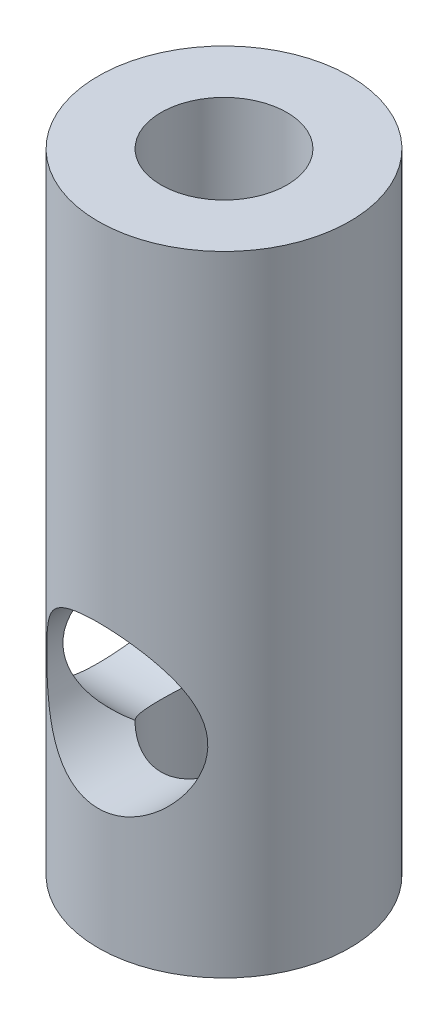
from build123d import *

# Parameters (mm, degrees)
SKETCH1_R           = 3.175
SKETCH1_R_2         = 1.5875
BOSS_EXTRUDE1_DEPTH = 15.875
SKETCH2_R           = 2.032
CUT_EXTRUDE1_DEPTH  = 17.497783942
CIRPATTERN1_COUNT   = 2
CIRPATTERN1_ANGLE   = 90


with BuildPart() as part:
    # Sketch1 → Boss-Extrude1 (new body)
    with BuildSketch(Plane(origin=(0, 0, 0), x_dir=(1, 0, 0), z_dir=(0, 1, 0))):
        with Locations(Location((0, 0, 0), (0, 0, 270))):
            Circle(SKETCH1_R)
        with Locations(Location((0, 0, 0), (0, 0, 270))):
            Circle(SKETCH1_R_2, mode=Mode.SUBTRACT)
    extrude(amount=BOSS_EXTRUDE1_DEPTH)

    # Sketch2 → Cut-Extrude1 (cut, through all)
    with BuildSketch(Plane(origin=(0, 0, 0), x_dir=(0, 0, -1), z_dir=(1, 0, 0))):
        with Locations(Location((0, 5.08, 0), (0, 0, 38.624832873))):
            Circle(SKETCH2_R)
    cut_extrude1 = extrude(amount=-CUT_EXTRUDE1_DEPTH, mode=Mode.SUBTRACT)

    # CirPattern1: Cut-Extrude1 ×2 about axis
    cirpattern1_axis = Axis((0, 0, 0), (0, 1, 0))
    for i in range(1, CIRPATTERN1_COUNT):
        add(cut_extrude1.rotate(cirpattern1_axis, i * CIRPATTERN1_ANGLE / (CIRPATTERN1_COUNT - 1)), mode=Mode.SUBTRACT)


solid = part.part
